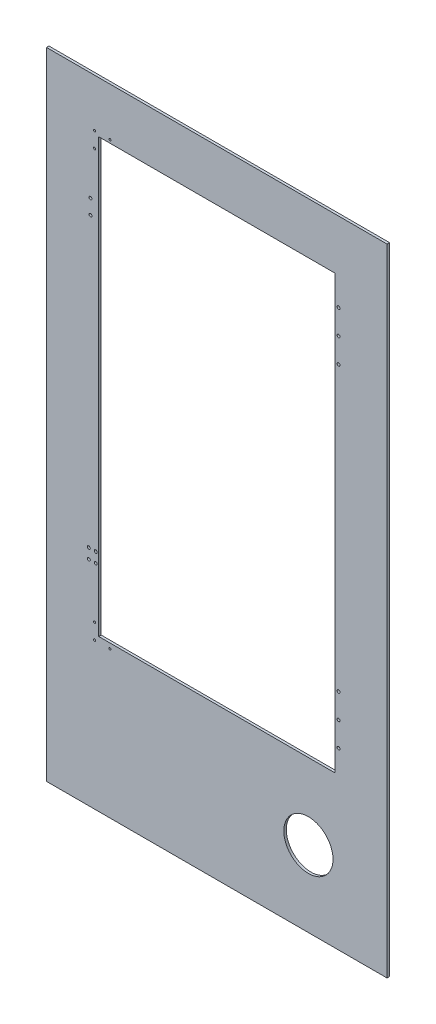
from build123d import *

# Parameters (mm, degrees)
SKETCH1_W           = 879.7036
SKETCH1_H           = 1641.475
BOSS_EXTRUDE1_DEPTH = 6.35
FILLET1_R           = 0.254
SKETCH2_W           = 609.6
SKETCH2_H           = 1117.6
CUT_EXTRUDE1_DEPTH  = 1863.353060507
SKETCH3_R           = 3.81
CUT_EXTRUDE2_DEPTH  = 1863.353060507
SKETCH5_R           = 63.5
CUT_EXTRUDE4_DEPTH  = 1863.353060507
SKETCH6_R           = 2.7
CUT_EXTRUDE5_DEPTH  = 1863.353060507


with BuildPart() as part:
    # Sketch1 → Boss-Extrude1 (new body)
    with BuildSketch(Plane.XY):
        with Locations((439.8518, -820.7375)):
            Rectangle(SKETCH1_W, SKETCH1_H)
    extrude(amount=BOSS_EXTRUDE1_DEPTH)

    # Fillet1
    fillet1_edges = [part.edges().sort_by_distance(p)[0] for p in [
        (879.7036, -1641.475, 3.175),
        (0, -1641.475, 3.175),
        (0, 0, 3.175),
        (879.7036, 0, 3.175),
    ]]
    fillet(fillet1_edges, radius=FILLET1_R)

    # Sketch2 → Cut-Extrude1 (cut, through all)
    with BuildSketch(Plane.XY.offset(6.35)):
        with Locations((439.8518, -691.134)):
            Rectangle(SKETCH2_W, SKETCH2_H)
    extrude(amount=-CUT_EXTRUDE1_DEPTH, mode=Mode.SUBTRACT)

    # Sketch3 → Cut-Extrude2 (cut, through all)
    with BuildSketch(Plane.XY.offset(6.35)):
        with Locations((754.3546, -204.724)):
            Circle(SKETCH3_R)
        with Locations((754.3546, -268.224)):
            Circle(SKETCH3_R)
        with Locations((754.3546, -331.724)):
            Circle(SKETCH3_R)
        with Locations((754.3546, -1190.244)):
            Circle(SKETCH3_R)
        with Locations((754.3546, -1126.744)):
            Circle(SKETCH3_R)
        with Locations((754.3546, -1063.244)):
            Circle(SKETCH3_R)
        with Locations((109.383049966, -1063.863000196)):
            Circle(SKETCH3_R)
        with Locations((127.383050034, -1063.863000196)):
            Circle(SKETCH3_R)
        with Locations((127.383050034, -1089.863000266)):
            Circle(SKETCH3_R)
        with Locations((109.383049966, -1089.863000266)):
            Circle(SKETCH3_R)
        with Locations((113.748448168, -280.289)):
            Circle(SKETCH3_R)
        with Locations((113.748448168, -318.389)):
            Circle(SKETCH3_R)
    extrude(amount=-CUT_EXTRUDE2_DEPTH, mode=Mode.SUBTRACT)

    # Sketch5 → Cut-Extrude4 (cut, through all)
    with BuildSketch(Plane.XY.offset(6.35)):
        with Locations((676.5036, -1445.7045)):
            Circle(SKETCH5_R)
    extrude(amount=-CUT_EXTRUDE4_DEPTH, mode=Mode.SUBTRACT)

    # Sketch6 → Cut-Extrude5 (cut, through all)
    with BuildSketch(Plane(origin=(0, 0, 0), x_dir=(-1, 0, 0), z_dir=(0, 0, -1))):
        with Locations(Location((-124.3, -1223.551, 0), (0, 0, 90))):
            Circle(SKETCH6_R)
        with Locations(Location((-124.3, -1263.175, 0), (0, 0, 90))):
            Circle(SKETCH6_R)
        with Locations(Location((-163.924, -1263.175, 0), (0, 0, 90))):
            Circle(SKETCH6_R)
        with Locations(Location((-163.924, -124.3, 0), (0, 0, 270))):
            Circle(SKETCH6_R)
        with Locations(Location((-124.3, -124.3, 0), (0, 0, 270))):
            Circle(SKETCH6_R)
        with Locations(Location((-124.3, -163.924, 0), (0, 0, 270))):
            Circle(SKETCH6_R)
    extrude(amount=-CUT_EXTRUDE5_DEPTH, mode=Mode.SUBTRACT)


solid = part.part
